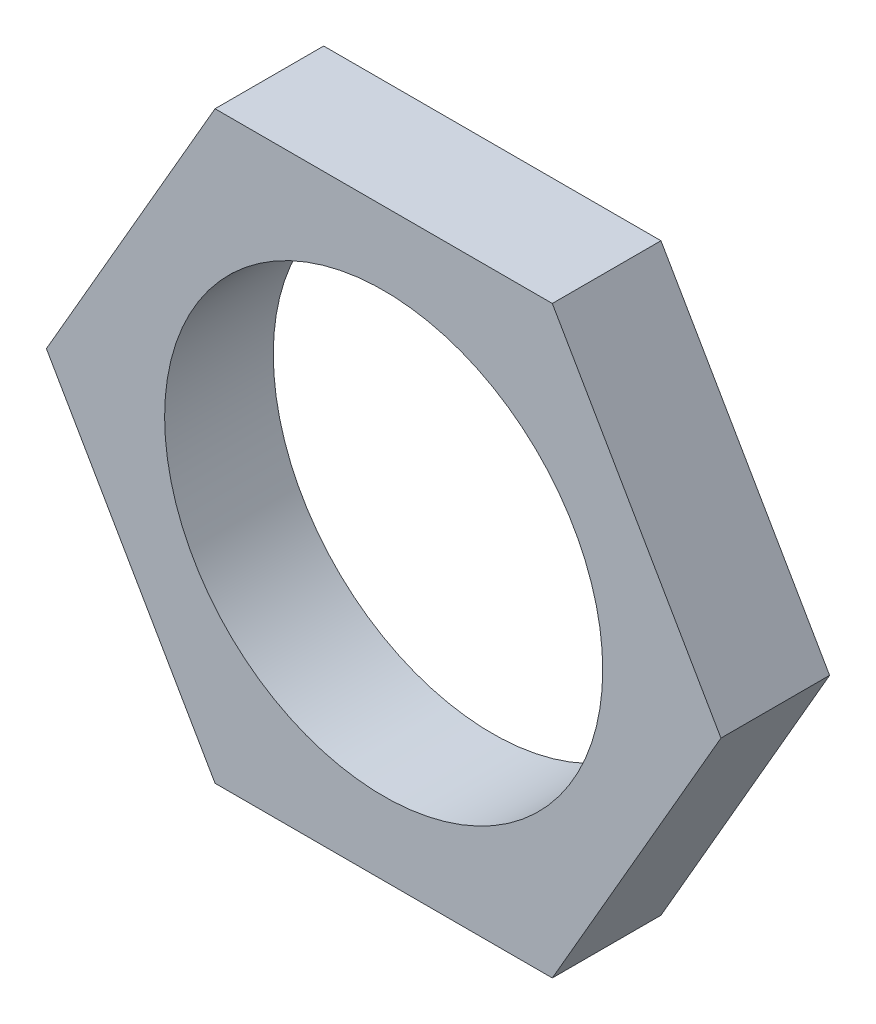
from build123d import *

# Parameters (mm, degrees)
BOSS_EXTRUDE1_DEPTH = 2.3622
SKETCH3_R           = 4.7625
CUT_EXTRUDE1_DEPTH  = 64.005303493


with BuildPart() as part:
    # Sketch2 → Boss-Extrude1 (new body)
    with BuildSketch(Plane.XY):
        Polygon((-58.541093471, -9.713090506), (-62.207267681, -3.363090506), (-58.541093471, 2.986909494), (-51.208745052, 2.986909494), (-47.542570843, -3.363090506), (-51.208745052, -9.713090506), align=None)
    extrude(amount=BOSS_EXTRUDE1_DEPTH)

    # Sketch3 → Cut-Extrude1 (cut, through all)
    with BuildSketch(Plane.XY.offset(2.3622)):
        with Locations((-54.874919262, -3.363090506)):
            Circle(SKETCH3_R)
    extrude(amount=-CUT_EXTRUDE1_DEPTH, mode=Mode.SUBTRACT)


solid = part.part
